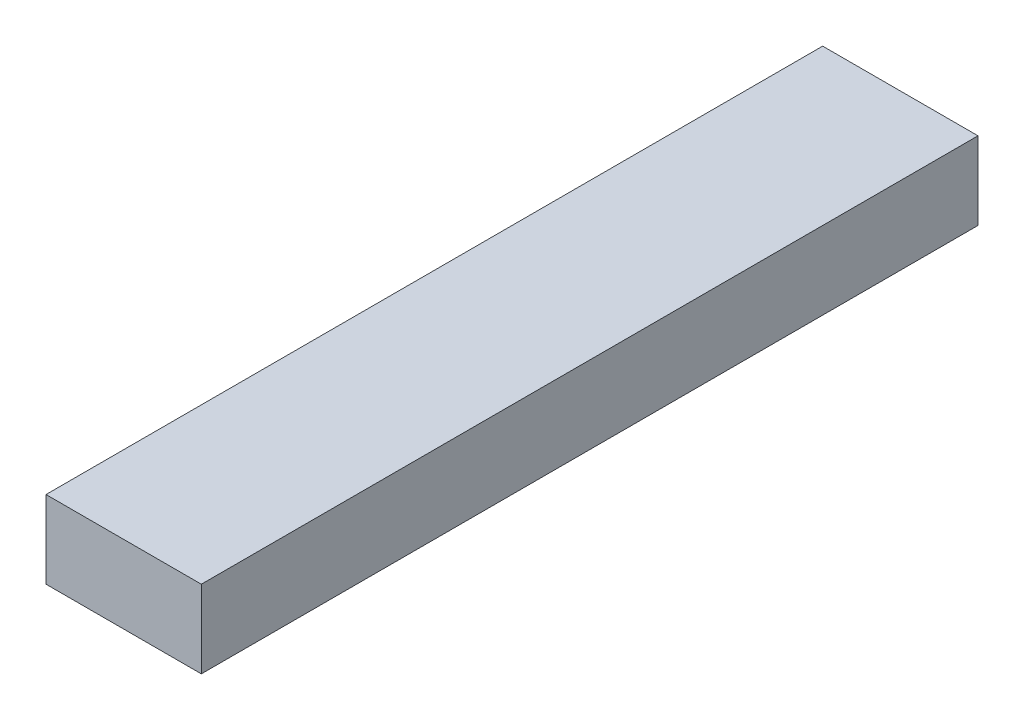
from build123d import *

# Parameters (mm, degrees)
SKETCH1_W           = 10
SKETCH1_H           = 5
BOSS_EXTRUDE1_DEPTH = 50


with BuildPart() as part:
    # Sketch1 → Boss-Extrude1 (new body)
    with BuildSketch(Plane.XY):
        with Locations((5, 2.5)):
            Rectangle(SKETCH1_W, SKETCH1_H)
    extrude(amount=BOSS_EXTRUDE1_DEPTH)


solid = part.part
